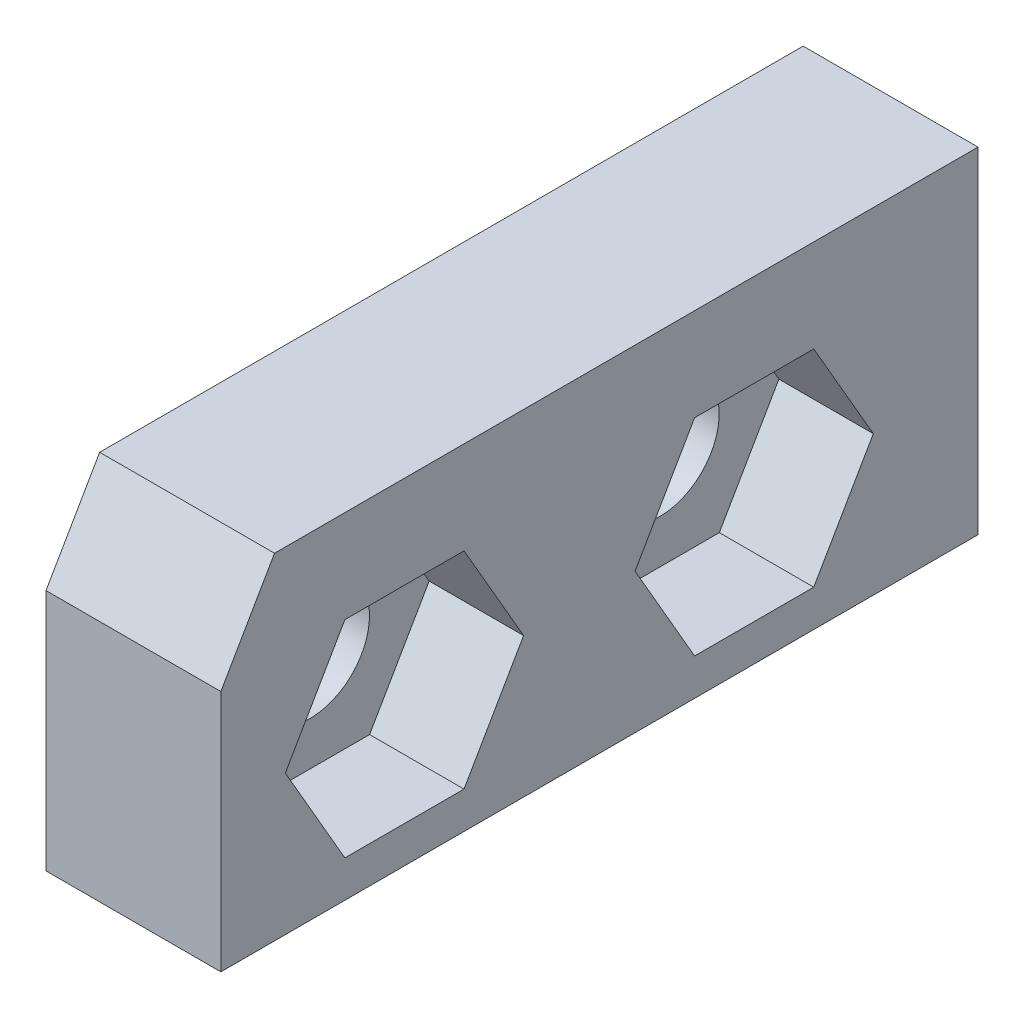
from build123d import *

# Parameters (mm, degrees)
KEEPER_START           = 0.55
SKETCH1_W              = 21.65
SKETCH1_H              = 9.6
KEEPER_DEPTH           = 5
BULKHEAD_START         = 0.35
BULKHEAD_CHAMFER_DEPTH = 5.4
TAB_START              = 0.35
SKETCH3_R              = 1.7
TAB_BOLT_HOLES_DEPTH   = 5.4
TAB_START_2            = 2.85
TAB_NUT_POCKETS_DEPTH  = 2.9


with BuildPart() as part:
    # Sketch1 → Keeper (new body)
    with BuildSketch(Plane(origin=(0, 0, 0), x_dir=(0, 0, -1), z_dir=(1, 0, 0)).offset(KEEPER_START)):
        with Locations((39.175, 117.7)):
            Rectangle(SKETCH1_W, SKETCH1_H)
    extrude(amount=KEEPER_DEPTH)

    # Sketch2 → Bulkhead chamfer (cut)
    with BuildSketch(Plane(origin=(0, 0, 0), x_dir=(0, 0, -1), z_dir=(1, 0, 0)).offset(BULKHEAD_START)):
        Polygon((21.8, 108.5), (21.8, 122.7), (30, 122.7), align=None)
    extrude(amount=BULKHEAD_CHAMFER_DEPTH, mode=Mode.SUBTRACT)

    # Sketch3 → Tab bolt holes (cut)
    with BuildSketch(Plane(origin=(0, 0, 0), x_dir=(0, 0, -1), z_dir=(1, 0, 0)).offset(TAB_START)):
        with Locations(Location((33.6, 116.9, 0), (0, 0, 180))):
            Circle(SKETCH3_R)
        with Locations(Location((43.6, 116.9, 0), (0, 0, 180))):
            Circle(SKETCH3_R)
    extrude(amount=TAB_BOLT_HOLES_DEPTH, mode=Mode.SUBTRACT)

    # Sketch4 → Tab nut pockets (cut)
    with BuildSketch(Plane(origin=(0, 0, 0), x_dir=(0, 0, -1), z_dir=(1, 0, 0)).offset(TAB_START_2)):
        Polygon((31.896816706, 119.85), (30.193633412, 116.9), (31.896816706, 113.95), (35.303183294, 113.95), (37.006366588, 116.9), (35.303183294, 119.85), align=None)
        Polygon((41.896816706, 119.85), (40.193633412, 116.9), (41.896816706, 113.95), (45.303183294, 113.95), (47.006366588, 116.9), (45.303183294, 119.85), align=None)
    extrude(amount=TAB_NUT_POCKETS_DEPTH, mode=Mode.SUBTRACT)


solid = part.part
